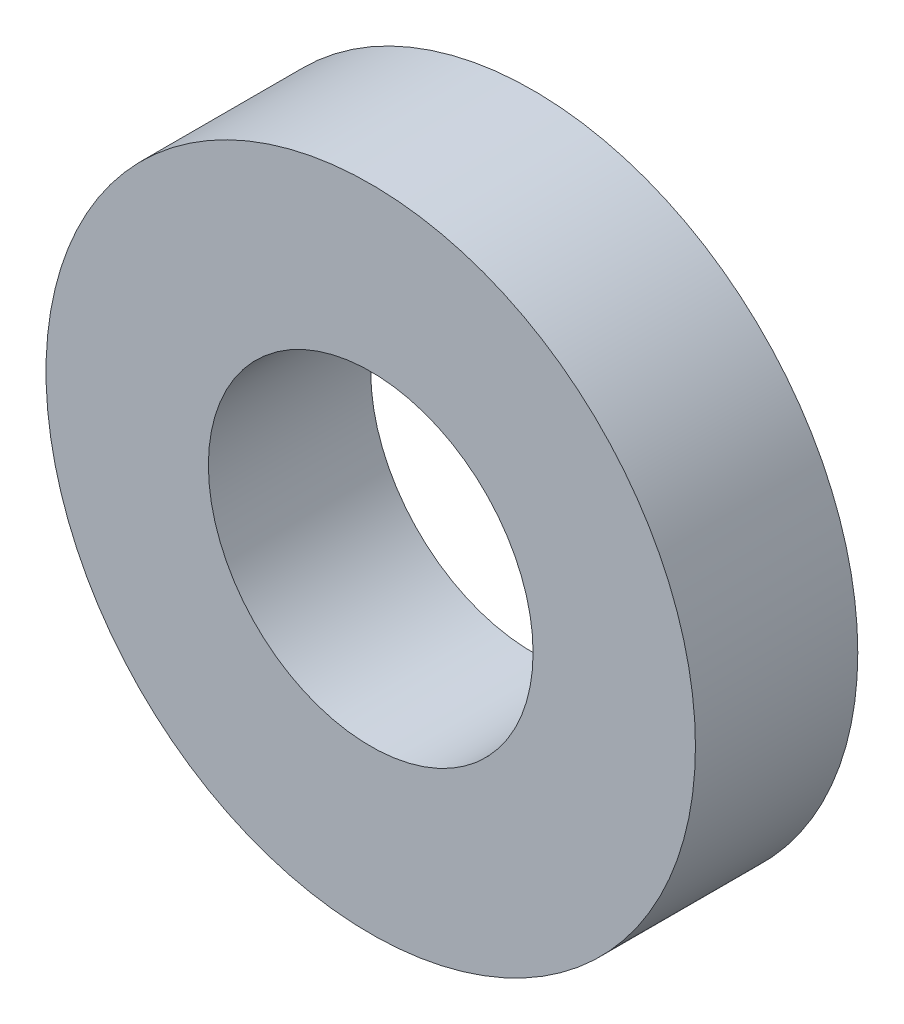
from build123d import *

# Parameters (mm, degrees)
SKETCH1_R     = 8
SKETCH1_R_2   = 4
PROFILE_DEPTH = 4


with BuildPart() as part:
    # Sketch1 → Profile (new body)
    with BuildSketch(Plane.XY):
        with Locations((8, 8)):
            Circle(SKETCH1_R)
        with Locations((8, 8)):
            Circle(SKETCH1_R_2, mode=Mode.SUBTRACT)
    extrude(amount=PROFILE_DEPTH)


solid = part.part
